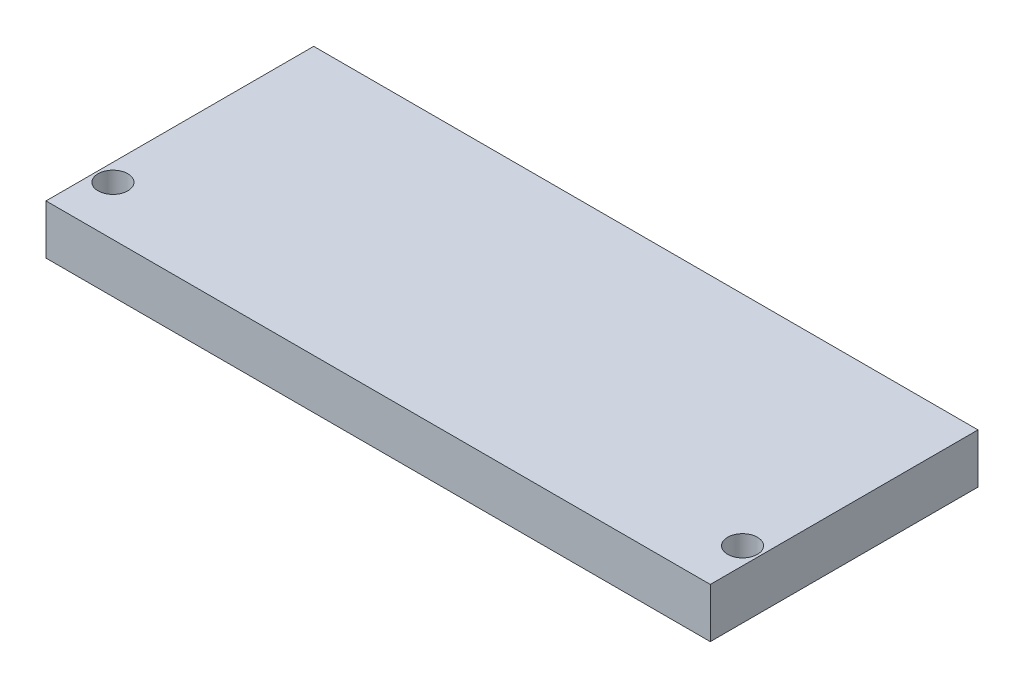
from build123d import *

# Parameters (mm, degrees)
SKETCH1_W           = 67
SKETCH1_H           = 27
SKETCH1_R           = 1.5
BOSS_EXTRUDE1_DEPTH = 5


with BuildPart() as part:
    # Sketch1 → Boss-Extrude1 (new body)
    with BuildSketch(Plane(origin=(0, 0, 0), x_dir=(1, 0, 0), z_dir=(0, 1, 0))):
        Rectangle(SKETCH1_W, SKETCH1_H)
        with Locations(Location((-31.75, -8.5, 0), (0, 0, 270))):
            Circle(SKETCH1_R, mode=Mode.SUBTRACT)
        with Locations(Location((31.75, -8.5, 0), (0, 0, 90))):
            Circle(SKETCH1_R, mode=Mode.SUBTRACT)
    extrude(amount=BOSS_EXTRUDE1_DEPTH)


solid = part.part
